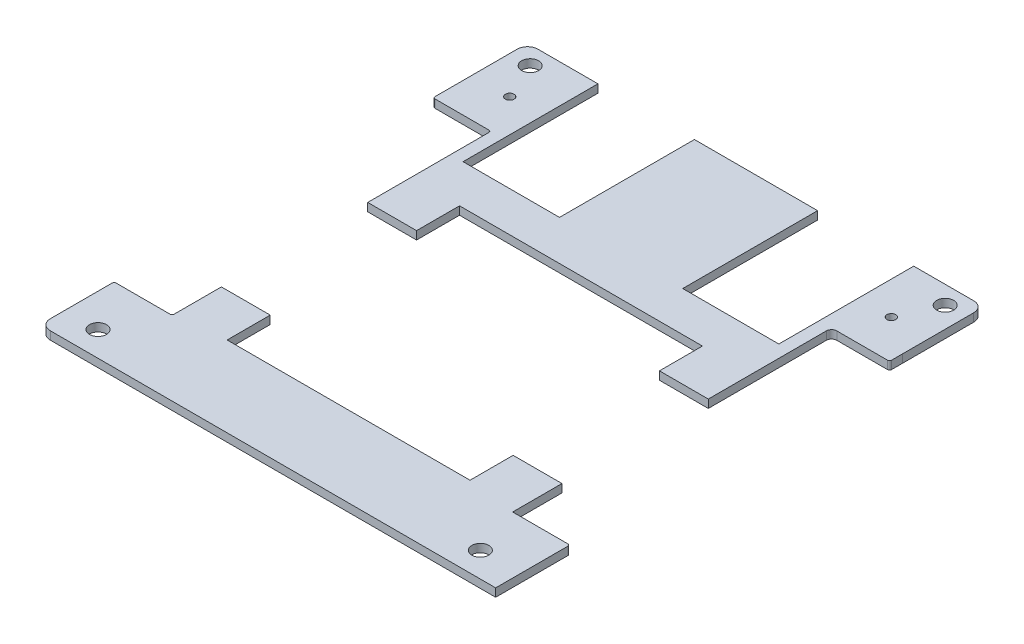
from build123d import *

# Parameters (mm, degrees)
SKETCH1_R           = 1.6383
BOSS_EXTRUDE1_DEPTH = 1.575
CUT_EXTRUDE1_DEPTH  = 2.54
SKETCH15_R          = 0.8382
CUT_EXTRUDE5_DEPTH  = 1.575
BOSS_EXTRUDE2_DEPTH = 1.575
CUT_EXTRUDE7_DEPTH  = 65.400936523


with BuildPart() as part:
    # Sketch1 → Boss-Extrude1 (new body)
    with BuildSketch(Plane(origin=(0, 0, 0), x_dir=(1, 0, 0), z_dir=(0, 1, 0))):
        with BuildLine():
            Line((-44, 45), (-44, 29.162404323))
            ThreePointArc((-44, 29.162404323), (-43.886381258, 28.888104416), (-43.612081351, 28.774485674))
            Line((-43.612081351, 28.774485674), (-33.211918649, 28.774485674))
            ThreePointArc((-33.211918649, 28.774485674), (-32.937618742, 28.660866933), (-32.824, 28.386567026))
            Line((-32.824, 28.386567026), (-32.824, -32.305595677))
            ThreePointArc((-32.824, -32.305595677), (-32.937618742, -32.579895584), (-33.211918649, -32.693514326))
            Line((-33.211918649, -32.693514326), (-36.100000052, -32.693514326))
            Line((-36.100000052, -32.693514326), (-43.612081299, -32.693514326))
            ThreePointArc((-43.612081299, -32.693514326), (-43.886381206, -32.807133067), (-43.999999948, -33.081432974))
            Line((-43.999999948, -33.081432974), (-43.999999948, -38.977))
            Line((-43.999999948, -38.977), (-43.999999948, -45))
            ThreePointArc((-43.999999948, -45), (-43.41421351, -46.414213562), (-41.999999948, -47))
            Line((-41.999999948, -47), (42.705916546, -47))
            Line((42.705916546, -47), (43.849731117, -47))
            Line((43.849731117, -47), (43.849731117, -38.27))
            Line((43.849731117, -38.27), (43.849731117, -33.081432974))
            ThreePointArc((43.849731117, -33.081432974), (43.736112376, -32.807133067), (43.461812469, -32.693514326))
            Line((43.461812469, -32.693514326), (36.098785193, -32.693514326))
            Line((36.098785193, -32.693514326), (33.824, -32.693514326))
            Line((33.824, -32.693514326), (32.822785141, -32.693514326))
            Line((32.822785141, -32.693514326), (32.822785141, -30.469351623))
            Line((32.822785141, -30.469351623), (32.822785141, 27.774485674))
            ThreePointArc((32.822785141, 27.774485674), (33.11567836, 28.481592456), (33.822785141, 28.774485674))
            Line((33.822785141, 28.774485674), (43.611054239, 28.774485674))
            ThreePointArc((43.611054239, 28.774485674), (43.885287743, 28.88803803), (43.998972842, 29.162216531))
            Line((43.998972842, 29.162216531), (44, 31.284))
            Line((44, 31.284), (44, 45))
            ThreePointArc((44, 45), (43.414213562, 46.414213562), (42, 47))
            Line((42, 47), (-42, 47))
            ThreePointArc((-42, 47), (-43.414213562, 46.414213562), (-44, 45))
        make_face()
        with Locations(Location((40, 43.5, 0), (0, 0, 270))):
            Circle(SKETCH1_R, mode=Mode.SUBTRACT)
        with Locations(Location((-40, 43.5, 0), (0, 0, 270))):
            Circle(SKETCH1_R, mode=Mode.SUBTRACT)
        with Locations(Location((-37.599999948, -42.2, 0), (0, 0, 270))):
            Circle(SKETCH1_R, mode=Mode.SUBTRACT)
        with Locations(Location((36.100000052, -42.2, 0), (0, 0, 270))):
            Circle(SKETCH1_R, mode=Mode.SUBTRACT)
        Polygon((23.409, -31.5), (-23.409, -31.5), (-23.409, 13.29544), (-12.909, 13.29544), (-12.909, 25.99544), (12.909, 25.99544), (12.909, 13.29544), (23.409, 13.29544), align=None, mode=Mode.SUBTRACT)
    extrude(amount=BOSS_EXTRUDE1_DEPTH)

    # Sketch2 → Cut-Extrude1 (cut)
    with BuildSketch(Plane(origin=(0, 1.575, 0), x_dir=(1, 0, 0), z_dir=(0, 1, 0))):
        Polygon((-12.909, 19.06), (-30.435, 19.06), (-30.435, 47), (30.435, 47), (30.435, 19.06), (12.909, 19.06), (12.909, 25.99544), (-12.909, 25.99544), align=None)
    extrude(amount=-CUT_EXTRUDE1_DEPTH, mode=Mode.SUBTRACT)

    # Sketch15 → Cut-Extrude5 (cut)
    with BuildSketch(Plane(origin=(0, 1.575, 0), x_dir=(1, 0, 0), z_dir=(0, 1, 0))):
        with Locations(Location((-36.785, 36.35, 0), (0, 0, 270))):
            Circle(SKETCH15_R)
        with Locations(Location((36.785, 36.332, 0), (0, 0, 270))):
            Circle(SKETCH15_R)
    extrude(amount=-CUT_EXTRUDE5_DEPTH, mode=Mode.SUBTRACT)

    # Sketch16 → Boss-Extrude2 (add)
    with BuildSketch(Plane(origin=(0, 1.575, 0), x_dir=(1, 0, 0), z_dir=(0, 1, 0))):
        Polygon((12.909, 19.06), (12.909, 13.29544), (-12.909, 13.29544), (-12.909, 19.06), (-30.435, 19.06), (-30.435, 21), (-11.838888217, 21), (-11.838888217, 47), (11.909, 47), (11.909, 21), (30.435, 21), (30.435, 19.06), align=None)
    extrude(amount=-BOSS_EXTRUDE2_DEPTH)

    # Sketch17 → Cut-Extrude7 (cut, through all)
    with BuildSketch(Plane(origin=(0, 1.575, 0), x_dir=(1, 0, 0), z_dir=(0, 1, 0))):
        Polygon((-42.620402532, -10.524407413), (-42.620402532, -23.19180025), (43.180071614, -23.19180025), (43.180071614, -10.524407413), (43.180071614, 5.014261133), (-42.620402532, 5.014261133), align=None)
    extrude(amount=-CUT_EXTRUDE7_DEPTH, mode=Mode.SUBTRACT)


with BuildPart() as cut_extrude7_piece_1:
    # of the separate pieces the step leaves, piece 1, a body of its own (cut_extrude7_pieces)
    add(part.part.solids().sort_by_distance((-44, 0, -45))[0])


with BuildPart() as cut_extrude7_piece_2:
    # of the separate pieces the step leaves, piece 2, a body of its own (cut_extrude7_pieces)
    add(part.part.solids().sort_by_distance((-32.824, 0, 23.19180025))[0])


solid = Compound([cut_extrude7_piece_1.part, cut_extrude7_piece_2.part])
